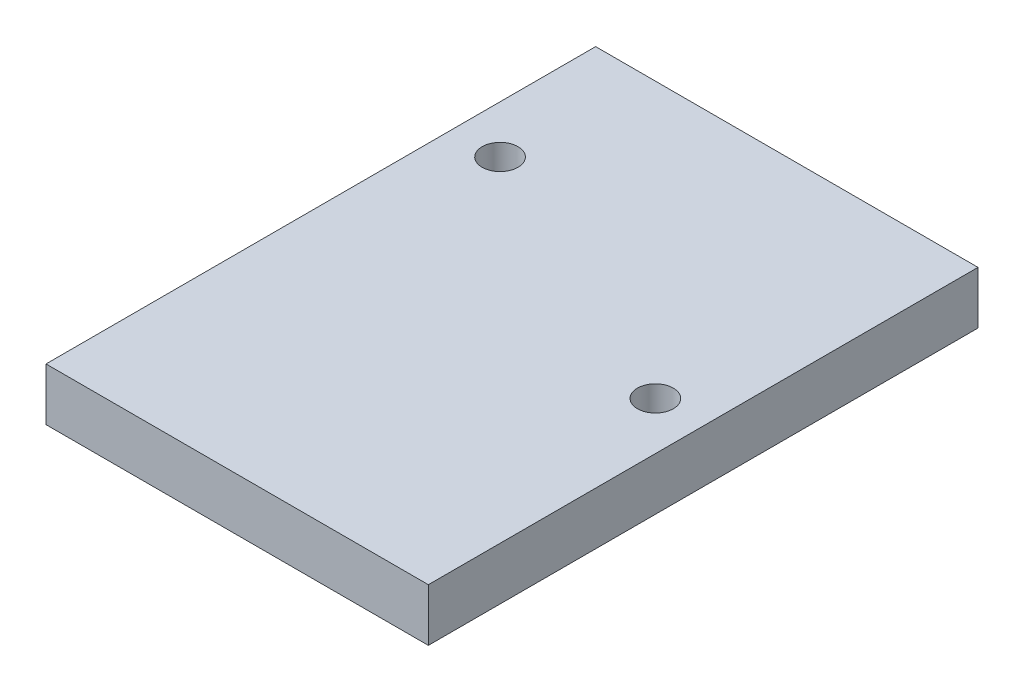
from build123d import *

# Parameters (mm, degrees)
SKETCH_1_W      = 16
SKETCH_1_H      = 23
SKETCH_1_R      = 0.75
EXTRUDE_1_DEPTH = 2.2


with BuildPart() as part:
    # 草图1 → 凸台-拉伸1 (new body)
    with BuildSketch(Plane(origin=(0, 0, 0), x_dir=(1, 0, 0), z_dir=(0, 1, 0))):
        with Locations((8, -11.5)):
            Rectangle(SKETCH_1_W, SKETCH_1_H)
        with Locations(Location((14, -11.5, 0), (0, 0, 270))):
            Circle(SKETCH_1_R, mode=Mode.SUBTRACT)
        with Locations(Location((2, -6, 0), (0, 0, 270))):
            Circle(SKETCH_1_R, mode=Mode.SUBTRACT)
    extrude(amount=EXTRUDE_1_DEPTH)


solid = part.part
